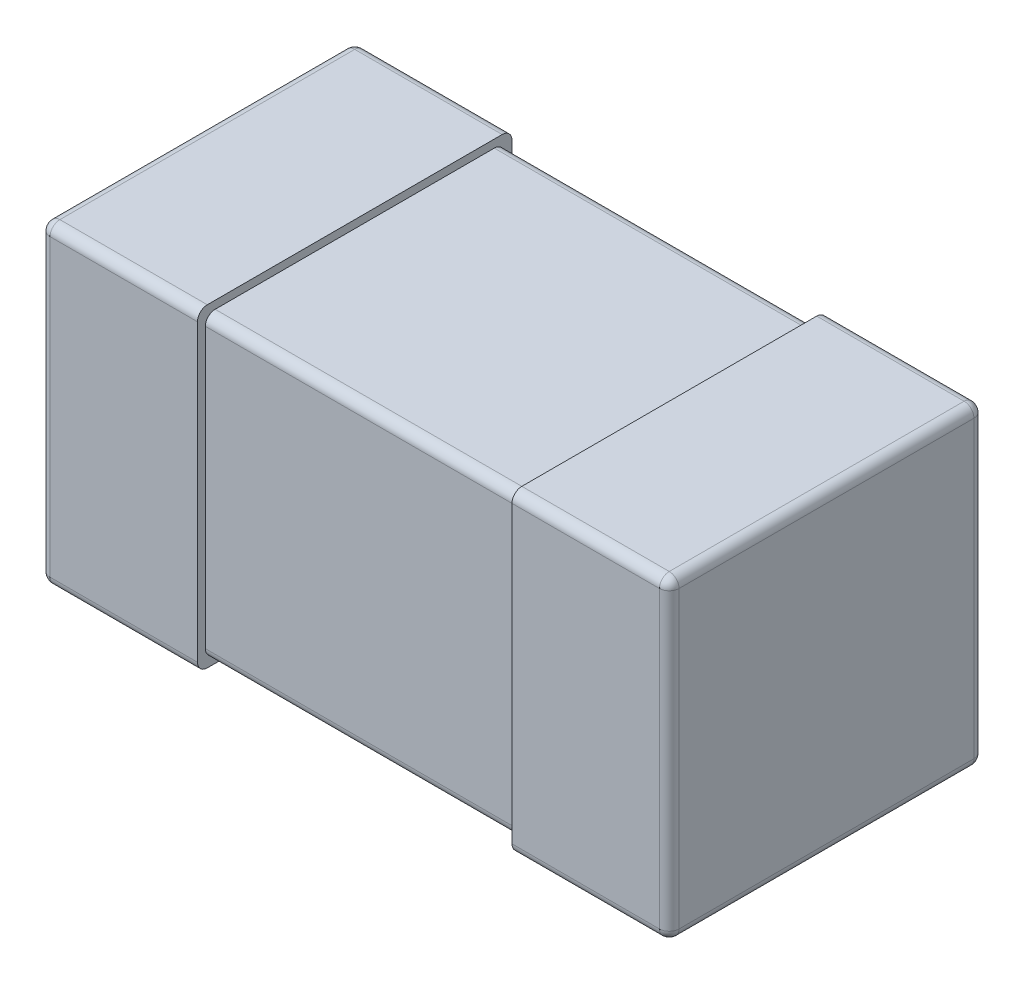
from build123d import *

# Parameters (mm, degrees)
SKETCH_3_W        = 0.4
SKETCH_3_H        = 0.8
EXTRUDE_3_DEPTH   = 0.8
EXTRUDE_3_2_DEPTH = 0.8
EXTRUDE_START     = 0.02
SKETCH_4_W        = 0.8
SKETCH_4_H        = 0.76
EXTRUDE_3_3_DEPTH = 0.76
FILLET_2_R        = 0.025
FILLET_3_R        = 0.025


with BuildPart() as part:
    # Эскиз3 → Extrude 3 (new body)
    with BuildSketch(Plane.XY):
        with Locations((0.6, 0)):
            Rectangle(SKETCH_3_W, SKETCH_3_H)
    extrude(amount=EXTRUDE_3_DEPTH)



with BuildPart() as body_2:
    # Эскиз3 → Extrude 3 2 (new body)
    with BuildSketch(Plane.XY):
        with Locations((-0.6, 0)):
            Rectangle(SKETCH_3_W, SKETCH_3_H)
    extrude(amount=EXTRUDE_3_2_DEPTH)


with BuildPart() as part_1:
    add(part.part)

    add(body_2.part)  # Extrude 3 3 merges body 2
    # Эскиз4 → Extrude 3 3 (add)
    with BuildSketch(Plane.XY.offset(EXTRUDE_START)):
        Rectangle(SKETCH_4_W, SKETCH_4_H)
    extrude(amount=EXTRUDE_3_3_DEPTH)

    # Скругление2
    fillet_2_edges = [part_1.edges().sort_by_distance(p)[0] for p in [
        (-0.8, 0, 0.8),
        (-0.6, -0.4, 0.8),
        (0.6, 0.4, 0),
        (0.8, 0.4, 0.4),
        (0.6, -0.4, 0),
        (0.8, 0, 0),
        (0.8, -0.4, 0.4),
        (0.6, 0.4, 0.8),
        (0.6, -0.4, 0.8),
        (0.8, 0, 0.8),
        (-0.6, -0.4, 0),
        (-0.8, 0, 0),
        (-0.6, 0.4, 0),
        (-0.6, 0.4, 0.8),
        (-0.8, -0.4, 0.4),
        (-0.8, 0.4, 0.4),
    ]]
    fillet(fillet_2_edges, radius=FILLET_2_R)

    # Скругление3
    fillet_3_edges = [part_1.edges().sort_by_distance(p)[0] for p in [
        (0, -0.38, 0.02),
        (0, 0.38, 0.02),
        (0, 0.38, 0.78),
        (0, -0.38, 0.78),
    ]]
    fillet(fillet_3_edges, radius=FILLET_3_R)


solid = part_1.part
